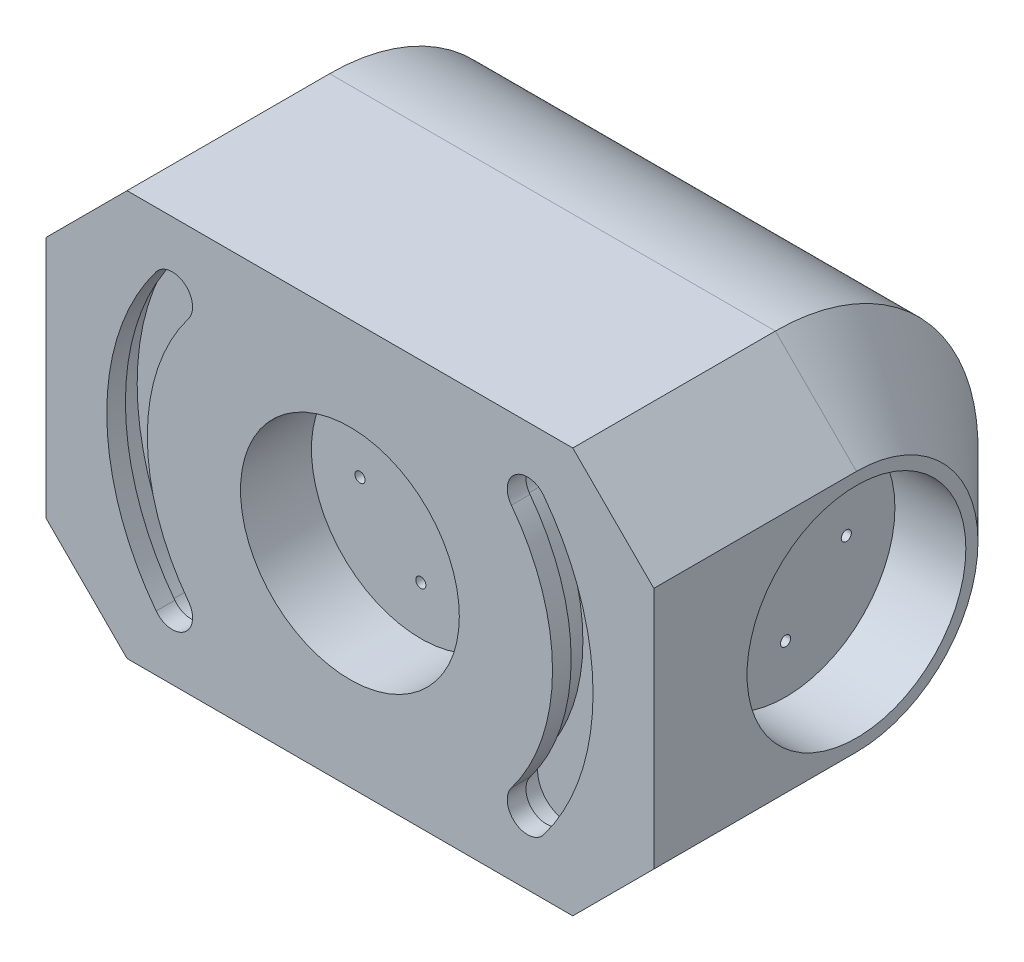
from build123d import *

# Parameters (mm, degrees)
SKETCH1_W           = 300
SKETCH1_H           = 200
BOSS_EXTRUDE1_DEPTH = 200
CUT_EXTRUDE1_DEPTH  = 375.165738677
SKETCH3_R           = 54
CUT_EXTRUDE2_DEPTH  = 35
CUT_EXTRUDE4_START  = -150
CUT_EXTRUDE4_DEPTH  = 150
CUT_EXTRUDE5_DEPTH  = 20
BOSS_EXTRUDE3_DEPTH = 9.2
SKETCH11_R          = 54
CUT_EXTRUDE6_DEPTH  = 35
CHAMFER1_SIZE       = 40
SKETCH13_R          = 2.5
CUT_EXTRUDE7_DEPTH  = 10
SKETCH14_R          = 2.5
CUT_EXTRUDE8_DEPTH  = 10
CUT_EXTRUDE9_DEPTH  = 105
SKETCH16_W          = 180
SKETCH16_H          = 50
CUT_EXTRUDE10_DEPTH = 15
SKETCH17_W          = 10
SKETCH17_H          = 50
CUT_EXTRUDE11_DEPTH = 5
SKETCH17_3_R        = 1.5
CUT_EXTRUDE12_DEPTH = 10


with BuildPart() as part:
    # Sketch1 → Boss-Extrude1 (new body)
    with BuildSketch(Plane.XY):
        Rectangle(SKETCH1_W, SKETCH1_H)
    extrude(amount=-BOSS_EXTRUDE1_DEPTH)

    # Sketch2 → Cut-Extrude1 (cut, through all)
    with BuildSketch(Plane(origin=(150, 0, 0), x_dir=(0, 0, -1), z_dir=(1, 0, 0))):
        with BuildLine():
            Line((200, -100), (200, 1.347e-06))
            ThreePointArc((200, 1.347e-06), (170.710678595, -70.710677643), (100, -100))
            Line((100, -100), (200, -100))
        make_face()
        with BuildLine():
            Line((200, 100), (100, 100))
            ThreePointArc((100, 100), (170.710677643, 70.710678595), (200, 1.347e-06))
            Line((200, 1.347e-06), (200, 100))
        make_face()
    extrude(amount=-CUT_EXTRUDE1_DEPTH, mode=Mode.SUBTRACT)

    # Sketch3 → Cut-Extrude2 (cut)
    with BuildSketch(Plane(origin=(150, 0, 0), x_dir=(0, 0, -1), z_dir=(1, 0, 0))):
        with Locations((100, 0)):
            Circle(SKETCH3_R)
    extrude(amount=-CUT_EXTRUDE2_DEPTH, mode=Mode.SUBTRACT)

    # Sketch6 → Cut-Extrude4 (cut)
    with BuildSketch(Plane.ZY.offset(150).offset(CUT_EXTRUDE4_START)):
        with BuildLine():
            Line((0, 100), (0, -100))
            Line((0, -100), (-100, -100))
            ThreePointArc((-100, -100), (-200, 0), (-100, 100))
            Line((-100, 100), (0, 100))
        make_face()
    extrude(amount=CUT_EXTRUDE4_DEPTH, mode=Mode.SUBTRACT)

    # Mirror1: part across plane


with BuildPart() as part_1:
    add(part.part)
    add(part.part.mirror(Plane(origin=(0, 0, -100), x_dir=(0, 0, 1), z_dir=(1, 0, 0))))

    # Sketch7 → Cut-Extrude5 (cut)
    with BuildSketch(Plane.XY):
        with BuildLine():
            ThreePointArc((-99.615655403, 75.509742408), (-125, 0), (-99.615655403, -75.509742408))
            ThreePointArc((-99.615655403, -75.509742408), (-78.600607666, -78.402451968), (-75.707898107, -57.38740423))
            ThreePointArc((-75.707898107, -57.38740423), (-95, 0), (-75.707898107, 57.38740423))
            ThreePointArc((-75.707898107, 57.38740423), (-78.600607666, 78.402451968), (-99.615655403, 75.509742408))
        make_face()
        with BuildLine():
            ThreePointArc((75.707898107, 57.38740423), (78.600607666, 78.402451968), (99.615655403, 75.509742408))
            ThreePointArc((99.615655403, 75.509742408), (125, 0), (99.615655403, -75.509742408))
            ThreePointArc((99.615655403, -75.509742408), (78.600607666, -78.402451968), (75.707898107, -57.38740423))
            ThreePointArc((75.707898107, -57.38740423), (95, 0), (75.707898107, 57.38740423))
        make_face()
    extrude(amount=-CUT_EXTRUDE5_DEPTH, mode=Mode.SUBTRACT)

    # Sketch10 → Boss-Extrude3 (add)
    # profile 1 of 2: a face of its own
    with BuildSketch(Plane.XY):
        with BuildLine():
            ThreePointArc((-75.707898107, 57.38740423), (-95, 0), (-75.707898107, -57.38740423))
            ThreePointArc((-75.707898107, -57.38740423), (-78.600607666, -78.402451968), (-99.615655403, -75.509742408))
            ThreePointArc((-99.615655403, -75.509742408), (-125, 0), (-99.615655403, 75.509742408))
            ThreePointArc((-99.615655403, 75.509742408), (-78.600607666, 78.402451968), (-75.707898107, 57.38740423))
        make_face()
        with BuildLine():
            ThreePointArc((-79.692524323, 60.407793927), (-100, 0), (-79.692524323, -60.407793927))
            ThreePointArc((-79.692524323, -60.407793927), (-81.620997362, -74.417825752), (-95.631029187, -72.489352712))
            ThreePointArc((-95.631029187, -72.489352712), (-120, 0), (-95.631029187, 72.489352712))
            ThreePointArc((-95.631029187, 72.489352712), (-81.620997362, 74.417825752), (-79.692524323, 60.407793927))
        make_face(mode=Mode.SUBTRACT)
    # profile 2 of 2: a face of its own
    with BuildSketch(Plane.XY):
        with BuildLine():
            ThreePointArc((75.707898107, -57.38740423), (78.600607666, -78.402451968), (99.615655403, -75.509742408))
            ThreePointArc((99.615655403, -75.509742408), (125, 0), (99.615655403, 75.509742408))
            ThreePointArc((99.615655403, 75.509742408), (78.600607666, 78.402451968), (75.707898107, 57.38740423))
            ThreePointArc((75.707898107, 57.38740423), (95, 0), (75.707898107, -57.38740423))
        make_face()
        with BuildLine():
            ThreePointArc((79.692524323, -60.407793927), (81.620997362, -74.417825752), (95.631029187, -72.489352712))
            ThreePointArc((95.631029187, -72.489352712), (120, 0), (95.631029187, 72.489352712))
            ThreePointArc((95.631029187, 72.489352712), (81.620997362, 74.417825752), (79.692524323, 60.407793927))
            ThreePointArc((79.692524323, 60.407793927), (100, 0), (79.692524323, -60.407793927))
        make_face(mode=Mode.SUBTRACT)
    extrude(amount=-BOSS_EXTRUDE3_DEPTH)

    # Sketch11 → Cut-Extrude6 (cut)
    with BuildSketch(Plane.XY):
        Circle(SKETCH11_R)
    extrude(amount=-CUT_EXTRUDE6_DEPTH, mode=Mode.SUBTRACT)

    # Chamfer1
    chamfer1_edges = [part_1.edges().sort_by_distance(p)[0] for p in [
        (-150, 100, -50),
        (-150, 0, -200),
        (-150, -100, -50),
        (150, 100, -50),
        (150, 0, -200),
        (150, -100, -50),
    ]]
    chamfer(chamfer1_edges, length=CHAMFER1_SIZE)

    # Sketch13 → Cut-Extrude7 (cut)
    with BuildSketch(Plane.ZY.offset(115)):
        with Locations((-100, 30)):
            Circle(SKETCH13_R)
        with Locations((-130, 0)):
            Circle(SKETCH13_R)
        with Locations((-100, -30)):
            Circle(SKETCH13_R)
        with Locations((-70, 0)):
            Circle(SKETCH13_R)
    cut_extrude7 = extrude(amount=-CUT_EXTRUDE7_DEPTH, mode=Mode.SUBTRACT)

    # Mirror2: Cut-Extrude7 across plane
    add(cut_extrude7.mirror(Plane(origin=(0, 0, 0), x_dir=(0, 0, 1), z_dir=(1, 0, 0))), mode=Mode.SUBTRACT)

    # Sketch14 → Cut-Extrude8 (cut)
    with BuildSketch(Plane.XY.offset(-35)):
        with Locations((0, 30)):
            Circle(SKETCH14_R)
        with Locations((-30, 0)):
            Circle(SKETCH14_R)
        with Locations((0, -30)):
            Circle(SKETCH14_R)
        with Locations((30, 0)):
            Circle(SKETCH14_R)
    extrude(amount=-CUT_EXTRUDE8_DEPTH, mode=Mode.SUBTRACT)

    # Sketch15 → Cut-Extrude9 (cut, symmetric)
    with BuildSketch(Plane(origin=(0, 0, 0), x_dir=(0, 0, -1), z_dir=(1, 0, 0))):
        with BuildLine():
            Line((45, -90), (100, -90))
            ThreePointArc((100, -90), (190, 0), (100, 90))
            Line((100, 90), (45, 90))
            Line((45, 90), (45, 32.5))
            Line((45, 32.5), (45, 27.5))
            Line((45, 27.5), (45, -90))
        make_face()
    extrude(amount=CUT_EXTRUDE9_DEPTH, both=True, mode=Mode.SUBTRACT)

    # Sketch16 → Cut-Extrude10 (cut)
    with BuildSketch(Plane.XZ.offset(100)):
        with Locations((0, -70)):
            Rectangle(SKETCH16_W, SKETCH16_H)
    extrude(amount=-CUT_EXTRUDE10_DEPTH, mode=Mode.SUBTRACT)

    # Sketch17 → Cut-Extrude11 (cut)
    with BuildSketch(Plane.XZ.offset(100)):
        with Locations((95, -70)):
            Rectangle(SKETCH17_W, SKETCH17_H)
        with Locations((-95, -70)):
            Rectangle(SKETCH17_W, SKETCH17_H)
    extrude(amount=-CUT_EXTRUDE11_DEPTH, mode=Mode.SUBTRACT)

    # Sketch17<3> → Cut-Extrude12 (cut)
    with BuildSketch(Plane.XZ.offset(100)):
        with Locations((-95, -50)):
            Circle(SKETCH17_3_R)
        with Locations((95, -50)):
            Circle(SKETCH17_3_R)
        with Locations((-95, -60)):
            Circle(SKETCH17_3_R)
        with Locations((95, -60)):
            Circle(SKETCH17_3_R)
        with Locations((-95, -70)):
            Circle(SKETCH17_3_R)
        with Locations((95, -70)):
            Circle(SKETCH17_3_R)
        with Locations((-95, -80)):
            Circle(SKETCH17_3_R)
        with Locations((95, -80)):
            Circle(SKETCH17_3_R)
        with Locations((-95, -90)):
            Circle(SKETCH17_3_R)
        with Locations((95, -90)):
            Circle(SKETCH17_3_R)
    extrude(amount=-CUT_EXTRUDE12_DEPTH, mode=Mode.SUBTRACT)


solid = part_1.part
